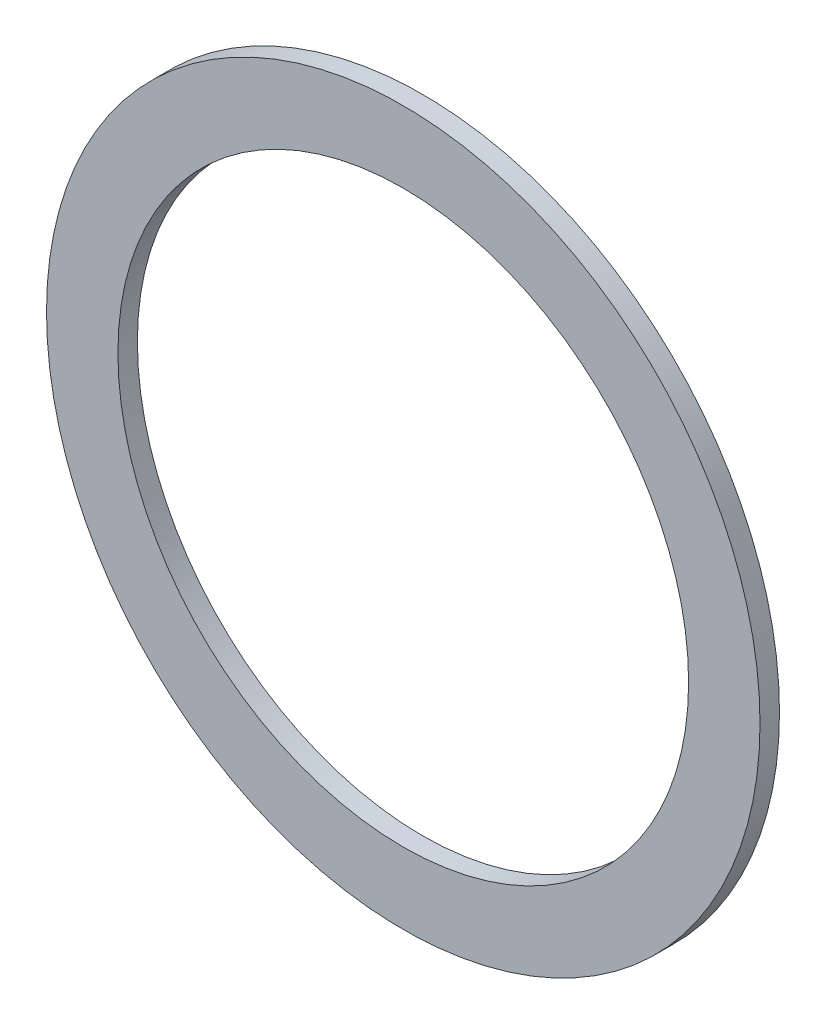
from build123d import *

# Parameters (mm, degrees)
SKETCH1_R           = 34.8996
SKETCH1_R_2         = 27.9146
BOSS_EXTRUDE1_DEPTH = 1.905


with BuildPart() as part:
    # Sketch1 → Boss-Extrude1 (new body)
    with BuildSketch(Plane.XY):
        with Locations(Location((0, 0, 0), (0, 0, 180))):
            Circle(SKETCH1_R)
        with Locations(Location((0, 0, 0), (0, 0, 180))):
            Circle(SKETCH1_R_2, mode=Mode.SUBTRACT)
    extrude(amount=BOSS_EXTRUDE1_DEPTH)


solid = part.part
